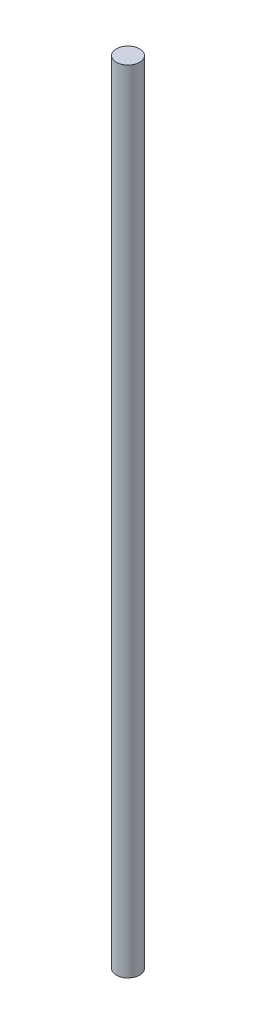
from build123d import *

# Parameters (mm, degrees)
SKETCH1_W = 1.3
SKETCH1_H = 88


with BuildPart() as part:
    # Sketch1 → Tendon (revolve)
    with BuildSketch(Plane.XY, mode=Mode.PRIVATE) as tendon_sk:
        with Locations((0.65, -44)):
            Rectangle(SKETCH1_W, SKETCH1_H)
    revolve(tendon_sk.sketch.rotate(Axis((0, -92, 0), (0, 1, 0)), 90), axis=Axis((0, -92, 0), (0, 1, 0)))


solid = part.part
